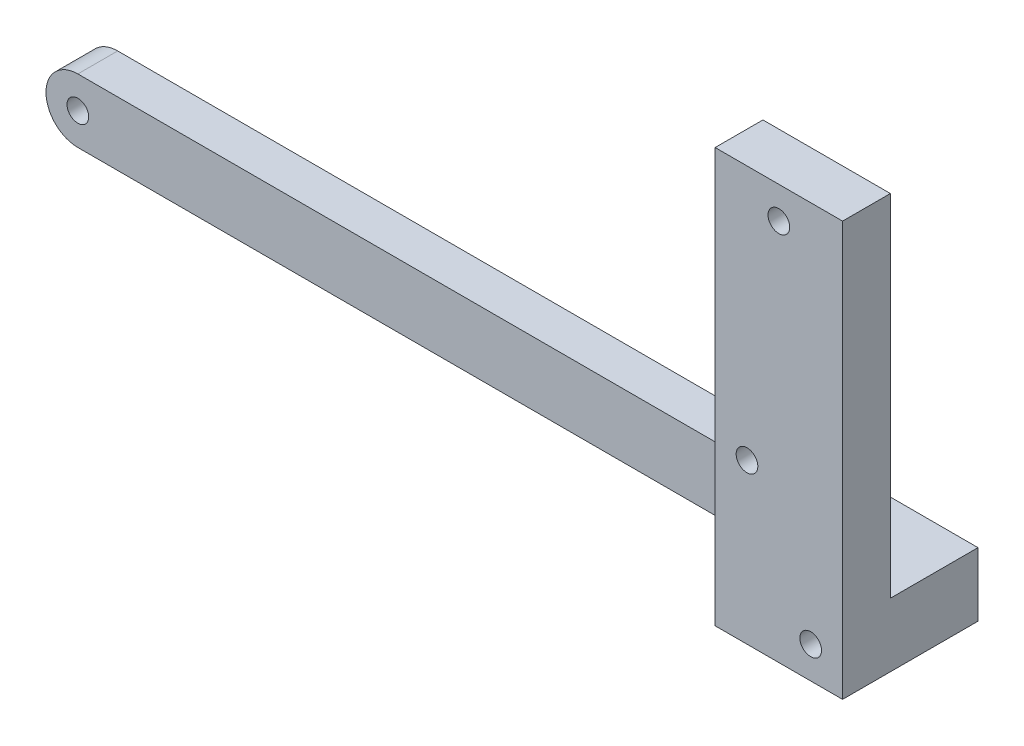
from build123d import *

# Parameters (mm, degrees)
SKETCH1_W           = 25.4
SKETCH1_H           = 82.55
SKETCH1_R           = 2.159
BOSS_EXTRUDE1_DEPTH = 9.525
SKETCH5_R           = 2.159
BOSS_EXTRUDE2_DEPTH = 7.9375
SKETCH6_W           = 25.4
SKETCH6_H           = 12.7
SKETCH6_R           = 2.159
BOSS_EXTRUDE3_DEPTH = 17.4625


with BuildPart() as part:
    # Sketch1 → Boss-Extrude1 (new body)
    with BuildSketch(Plane.XY):
        with Locations((0, -34.925)):
            Rectangle(SKETCH1_W, SKETCH1_H)
        with Locations(Location((0, 0, 0), (0, 0, 180))):
            Circle(SKETCH1_R, mode=Mode.SUBTRACT)
        with Locations(Location((-6.35, -44.45, 0), (0, 0, 180))):
            Circle(SKETCH1_R, mode=Mode.SUBTRACT)
        with Locations(Location((6.35, -69.85, 0), (0, 0, 180))):
            Circle(SKETCH1_R, mode=Mode.SUBTRACT)
    extrude(amount=BOSS_EXTRUDE1_DEPTH)

    # Sketch6 → Boss-Extrude3 (add)
    with BuildSketch(Plane.XY.offset(-17.4625)):
        with Locations((0, -69.85)):
            Rectangle(SKETCH6_W, SKETCH6_H)
        with Locations(Location((6.35, -69.85, 0), (0, 0, 180))):
            Circle(SKETCH6_R, mode=Mode.SUBTRACT)
    extrude(amount=BOSS_EXTRUDE3_DEPTH)


with BuildPart() as body_2:
    # Sketch5 → Boss-Extrude2 (new body)
    with BuildSketch(Plane.XY.offset(-17.4625)):
        with BuildLine():
            Line((-158.75, -76.2), (12.7, -76.2))
            Line((12.7, -76.2), (12.7, -63.5))
            Line((12.7, -63.5), (-158.75, -63.5))
            ThreePointArc((-158.75, -63.5), (-165.1, -69.85), (-158.75, -76.2))
        make_face()
        with Locations((-158.75, -69.85)):
            Circle(SKETCH5_R, mode=Mode.SUBTRACT)
    extrude(amount=BOSS_EXTRUDE2_DEPTH)


solid = Compound([part.part, body_2.part])
